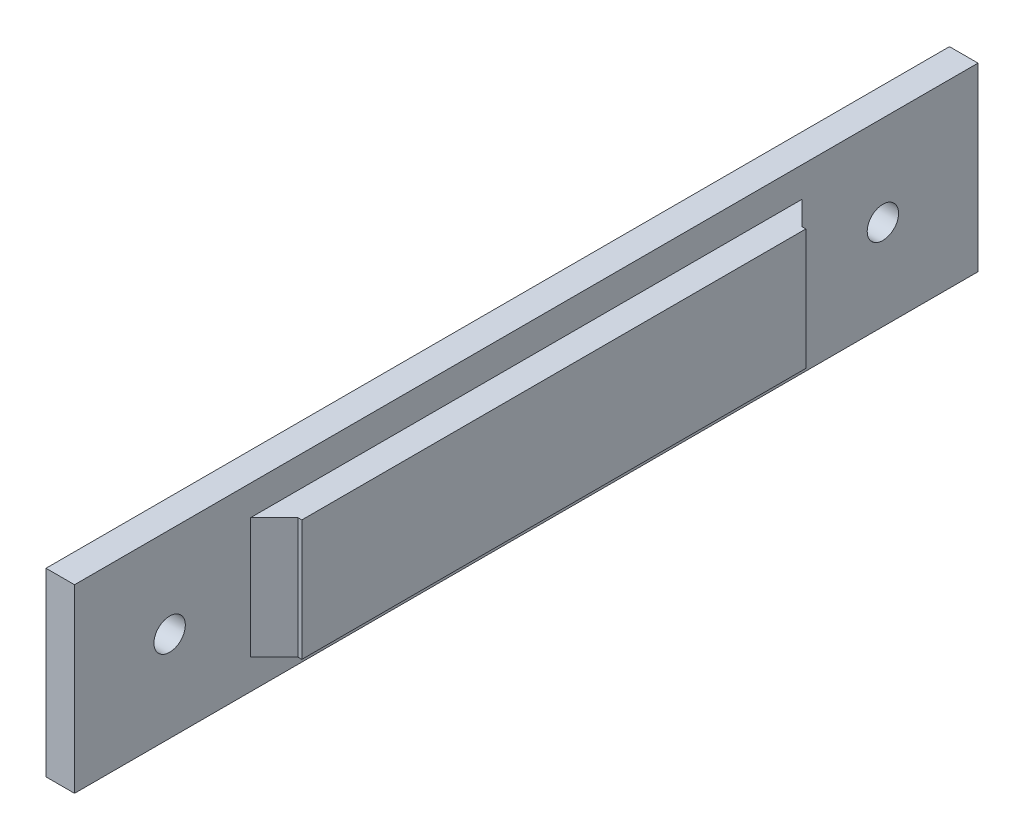
from build123d import *

# Parameters (mm, degrees)
SKETCH_1_W          = 19
SKETCH_1_H          = 19
SKETCH_1_W_2        = 13
SKETCH_1_H_2        = 13
EXTRUDE_1_DEPTH     = 95
SKETCH_2_R          = 1.65
CUT_EXTRUDE_1_DEPTH = 30
SKETCH_3_W          = 95
SKETCH_3_H          = 19
CUT_EXTRUDE_2_DEPTH = 16
SKETCH_4_W          = 53
SKETCH_4_H          = 12.7
EXTRUDE_1_2_DEPTH   = 2.9
CHAMFER_1_SIZE      = 2.5


with BuildPart() as part:
    # 草图1 → Extrude 1 (new body)
    with BuildSketch(Plane.XY):
        with Locations((6.5, 6.5)):
            Rectangle(SKETCH_1_W, SKETCH_1_H)
        with Locations((6.5, 6.5)):
            Rectangle(SKETCH_1_W_2, SKETCH_1_H_2, mode=Mode.SUBTRACT)
    extrude(amount=EXTRUDE_1_DEPTH)

    # 草图2 → 切除-拉伸1 (cut)
    with BuildSketch(Plane.ZY.offset(3)):
        with Locations((10, 6.5)):
            Circle(SKETCH_2_R)
        with Locations((85, 6.5)):
            Circle(SKETCH_2_R)
    extrude(amount=-CUT_EXTRUDE_1_DEPTH, mode=Mode.SUBTRACT)

    # 草图3 → 切除-拉伸2 (cut)
    with BuildSketch(Plane(origin=(16, 0, 0), x_dir=(0, 0, -1), z_dir=(1, 0, 0))):
        with Locations((-47.5, 6.5)):
            Rectangle(SKETCH_3_W, SKETCH_3_H)
    extrude(amount=-CUT_EXTRUDE_2_DEPTH, mode=Mode.SUBTRACT)

    # 草图4 → Extrude 1 2 (add)
    with BuildSketch(Plane(origin=(0, 0, 0), x_dir=(0, 0, -1), z_dir=(1, 0, 0))):
        with Locations((-47.5, 6.5)):
            Rectangle(SKETCH_4_W, SKETCH_4_H)
    extrude(amount=EXTRUDE_1_2_DEPTH)

    # 倒角1
    chamfer_1_edges = [part.edges().sort_by_distance(p)[0] for p in [
        (0, 6.5, 74),
        (0, 6.5, 21),
    ]]
    chamfer(chamfer_1_edges, length=CHAMFER_1_SIZE)


solid = part.part
